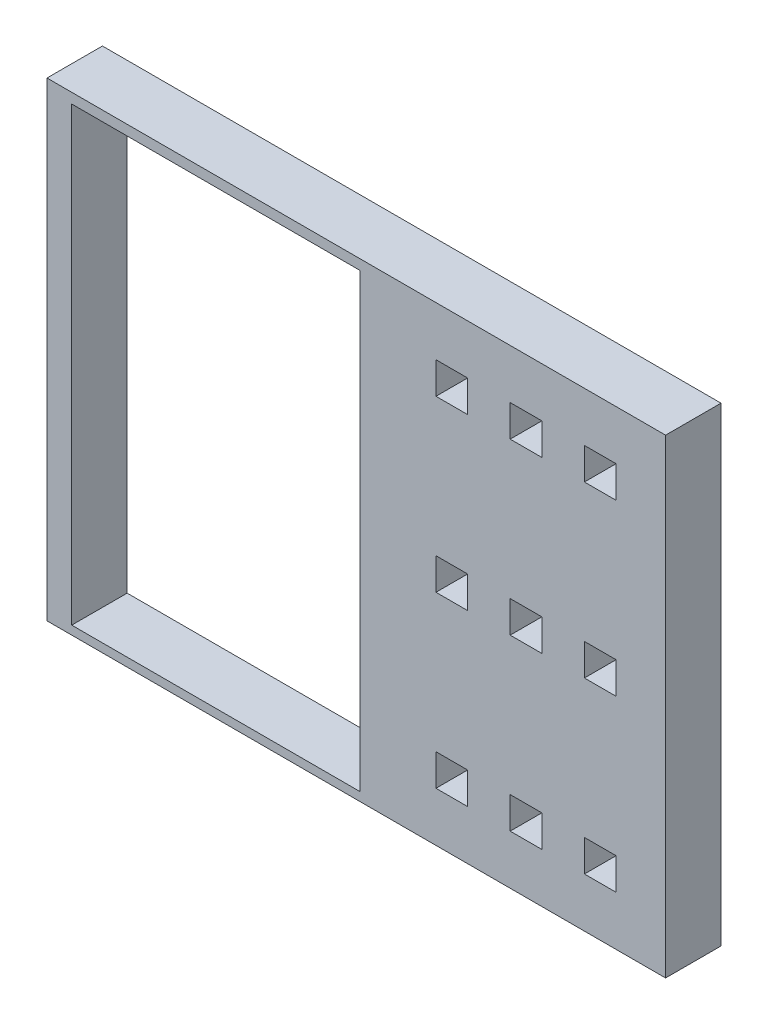
from build123d import *

# Parameters (mm, degrees)
CROQUIS1_W              = 125
CROQUIS1_H              = 95
SALIENTE_EXTRUIR1_DEPTH = 11.2
CROQUIS2_W              = 58.3
CROQUIS2_H              = 91.2
CROQUIS2_W_2            = 6.4
CROQUIS2_H_2            = 6.4
CORTAR_EXTRUIR1_DEPTH   = 32.5
CORTAR_EXTRUIR2_DEPTH   = 4


with BuildPart() as part:
    # Croquis1 → Saliente-Extruir1 (new body)
    with BuildSketch(Plane.XY):
        with Locations((-11.370773818, -8.561811531)):
            Rectangle(CROQUIS1_W, CROQUIS1_H)
    extrude(amount=SALIENTE_EXTRUIR1_DEPTH)

    # Croquis2 → Cortar-Extruir1 (cut)
    with BuildSketch(Plane(origin=(0, 0, 0), x_dir=(-1, 0, 0), z_dir=(0, 0, -1))):
        with Locations((39.720773818, -8.711811531)):
            Rectangle(CROQUIS2_W, CROQUIS2_H)
        with Locations((-37.929226182, 25.738188469)):
            Rectangle(CROQUIS2_W_2, CROQUIS2_H_2)
        with Locations((-22.929226182, 25.738188469)):
            Rectangle(CROQUIS2_W_2, CROQUIS2_H_2)
        with Locations((-7.929226182, 25.738188469)):
            Rectangle(CROQUIS2_W_2, CROQUIS2_H_2)
        with Locations((-22.929226182, -8.561811531)):
            Rectangle(CROQUIS2_W_2, CROQUIS2_H_2)
        with Locations((-7.929226182, -8.561811531)):
            Rectangle(CROQUIS2_W_2, CROQUIS2_H_2)
        with Locations((-22.929226182, -42.861811531)):
            Rectangle(CROQUIS2_W_2, CROQUIS2_H_2)
        with Locations((-7.929226182, -42.861811531)):
            Rectangle(CROQUIS2_W_2, CROQUIS2_H_2)
        with Locations((-37.929226182, -8.561811531)):
            Rectangle(CROQUIS2_W_2, CROQUIS2_H_2)
        with Locations((-37.929226182, -42.861811531)):
            Rectangle(CROQUIS2_W_2, CROQUIS2_H_2)
    extrude(amount=-CORTAR_EXTRUIR1_DEPTH, mode=Mode.SUBTRACT)

    # Croquis3 → Cortar-Extruir2 (cut)
    with BuildSketch(Plane(origin=(0, 0, 0), x_dir=(-1, 0, 0), z_dir=(0, 0, -1))):
        Polygon((-39.429226182, 22.538188469), (-39.429226182, 17.538188469), (10.570773818, 17.538188469), (10.570773818, 20.538188469), (-6.429226182, 20.538188469), (-6.429226182, 22.538188469), (-9.429226182, 22.538188469), (-9.429226182, 20.538188469), (-21.429226182, 20.538188469), (-21.429226182, 22.538188469), (-24.429226182, 22.538188469), (-24.429226182, 20.538188469), (-36.429226182, 20.538188469), (-36.429226182, 22.538188469), align=None)
        Polygon((-9.429226182, -11.761811531), (-6.429226182, -11.761811531), (-6.429226182, -13.761811531), (10.570773818, -13.761811531), (10.570773818, -16.761811531), (-39.429226182, -16.761811531), (-39.429226182, -11.761811531), (-36.429226182, -11.761811531), (-36.429226182, -13.761811531), (-24.429226182, -13.761811531), (-24.429226182, -11.761811531), (-21.429226182, -11.761811531), (-21.429226182, -13.761811531), (-9.429226182, -13.761811531), align=None)
        Polygon((-9.429226182, -46.061811531), (-6.429226182, -46.061811531), (-6.429226182, -48.061811531), (10.570773818, -48.061811531), (10.570773818, -51.061811531), (-39.429226182, -51.061811531), (-39.429226182, -46.061811531), (-36.429226182, -46.061811531), (-36.429226182, -48.061811531), (-24.429226182, -48.061811531), (-24.429226182, -46.061811531), (-21.429226182, -46.061811531), (-21.429226182, -48.061811531), (-9.429226182, -48.061811531), align=None)
    extrude(amount=-CORTAR_EXTRUIR2_DEPTH, mode=Mode.SUBTRACT)


solid = part.part
